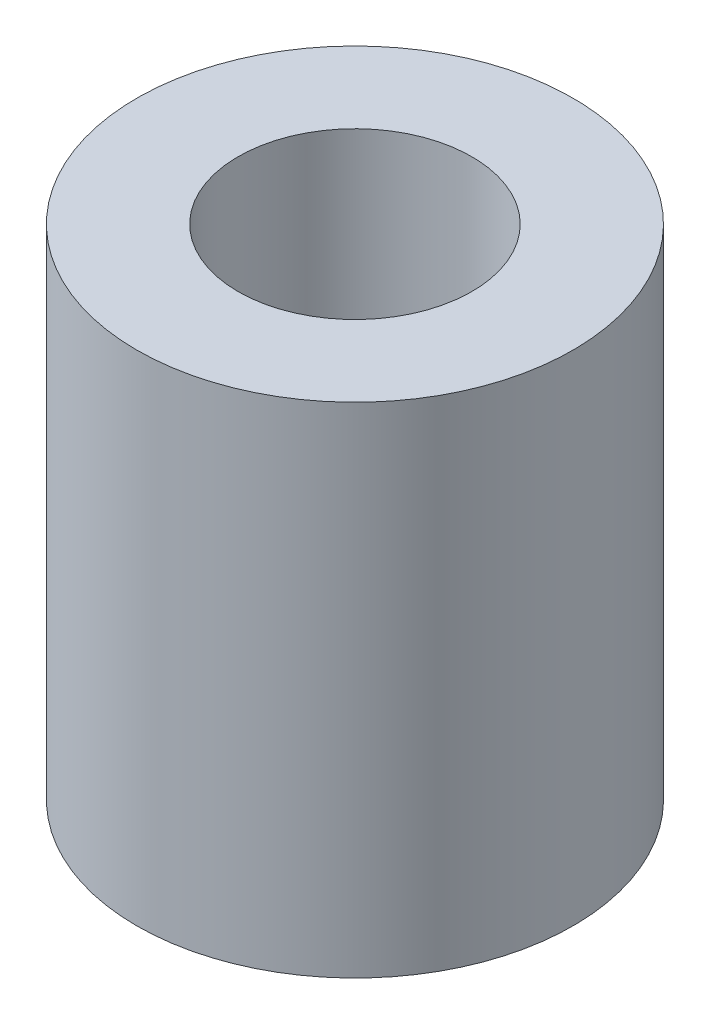
from build123d import *

# Parameters (mm, degrees)
CROQUIS1_R              = 3.5
CROQUIS1_R_2            = 1.875
SALIENTE_EXTRUIR1_DEPTH = 8


with BuildPart() as part:
    # Croquis1 → Saliente-Extruir1 (new body)
    with BuildSketch(Plane(origin=(0, 0, 0), x_dir=(1, 0, 0), z_dir=(0, 1, 0))):
        with Locations(Location((0, 0, 0), (0, 0, 270))):
            Circle(CROQUIS1_R)
        with Locations(Location((0, 0, 0), (0, 0, 270))):
            Circle(CROQUIS1_R_2, mode=Mode.SUBTRACT)
    extrude(amount=SALIENTE_EXTRUIR1_DEPTH)


solid = part.part
